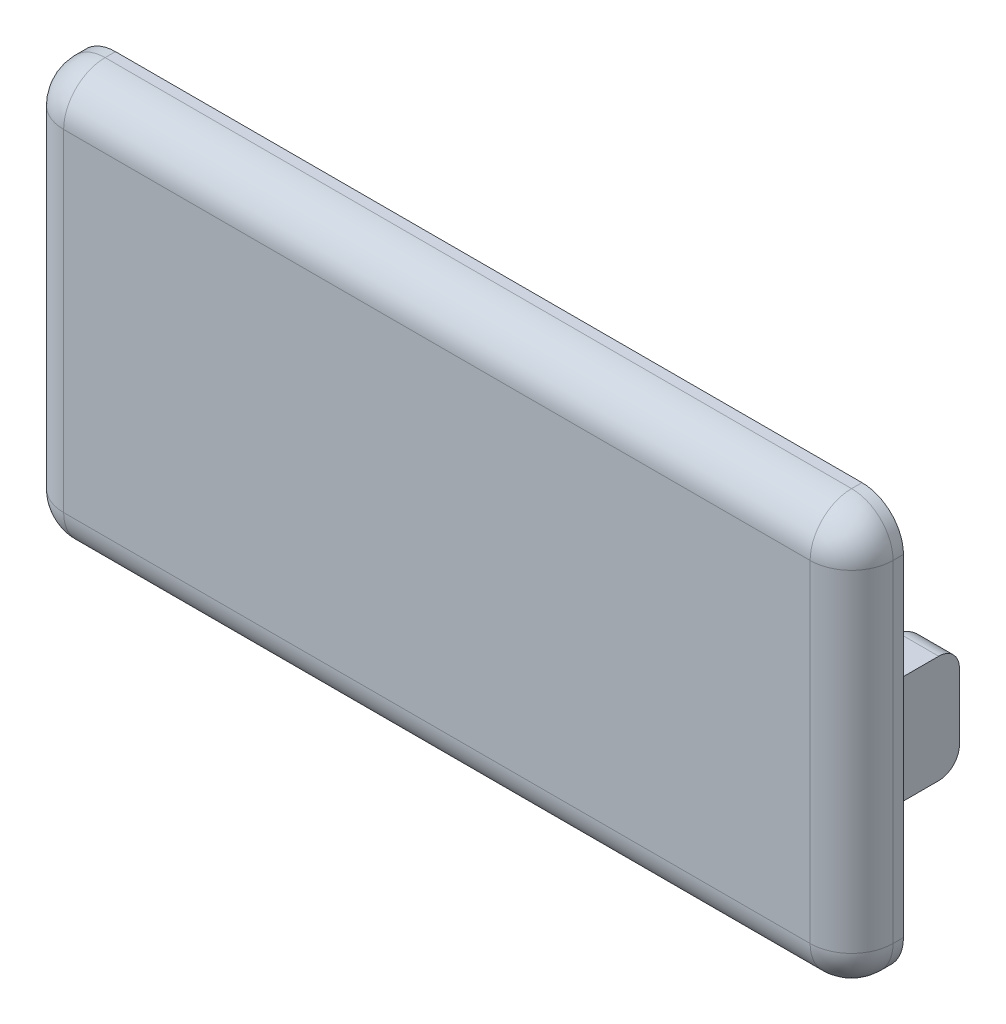
from build123d import *

# Parameters (mm, degrees)
SKETCH1_W           = 40
SKETCH1_H           = 20
BOSS_EXTRUDE1_DEPTH = 2.5
FILLET1_R           = 2
SKETCH2_W           = 34
SKETCH2_H           = 14
CUT_EXTRUDE1_DEPTH  = 1
BOSS_EXTRUDE2_DEPTH = 2.6
FILLET2_R           = 1
BOSS_EXTRUDE3_DEPTH = 7
BOSS_EXTRUDE4_DEPTH = 0.6
LPATTERN1_COUNT     = 2
LPATTERN1_PITCH     = 20


with BuildPart() as part:
    # Sketch1 → Boss-Extrude1 (new body)
    with BuildSketch(Plane.XY):
        Rectangle(SKETCH1_W, SKETCH1_H)
    extrude(amount=BOSS_EXTRUDE1_DEPTH)

    # Fillet1
    fillet1_edges = [part.edges().sort_by_distance(p)[0] for p in [
        (20, 0, 2.5),
        (0, 10, 2.5),
        (-20, 0, 2.5),
        (0, -10, 2.5),
        (-20, 10, 1.25),
        (20, 10, 1.25),
        (20, -10, 1.25),
        (-20, -10, 1.25),
    ]]
    fillet(fillet1_edges, radius=FILLET1_R)

    # Sketch2 → Cut-Extrude1 (cut)
    with BuildSketch(Plane(origin=(0, 0, 0), x_dir=(-1, 0, 0), z_dir=(0, 0, -1))):
        Rectangle(SKETCH2_W, SKETCH2_H)
    extrude(amount=-CUT_EXTRUDE1_DEPTH, mode=Mode.SUBTRACT)

    # Sketch3 → Boss-Extrude2 (add, symmetric)
    with BuildSketch(Plane(origin=(0, 0, 0), x_dir=(0, 0, -1), z_dir=(0, 1, 0))):
        Polygon((0, -17), (3, -18.091910703), (3, -19.7), (0, -19.7), align=None)
    extrude(amount=BOSS_EXTRUDE2_DEPTH, both=True)

    # Fillet2
    fillet2_edges = [part.edges().sort_by_distance(p)[0] for p in [
        (18.895955351, -2.6, -3),
        (18.895955351, 2.6, -3),
    ]]
    fillet(fillet2_edges, radius=FILLET2_R)

    # Sketch4 → Boss-Extrude3 (add)
    with BuildSketch(Plane(origin=(0, 0, 1), x_dir=(-1, 0, 0), z_dir=(0, 0, -1))):
        with BuildLine():
            Line((-12.015564437, -1), (-11, -1))
            Line((-11, -1), (-11, -2.015564437))
            ThreePointArc((-11, -2.015564437), (-10, -2.25), (-9, -2.015564437))
            Line((-9, -2.015564437), (-9, -1))
            Line((-9, -1), (-7.984435563, -1))
            ThreePointArc((-7.984435563, -1), (-7.75, 0), (-7.984435563, 1))
            Line((-7.984435563, 1), (-9, 1))
            Line((-9, 1), (-9, 2.015564437))
            ThreePointArc((-9, 2.015564437), (-10, 2.25), (-11, 2.015564437))
            Line((-11, 2.015564437), (-11, 1))
            Line((-11, 1), (-12.015564437, 1))
            ThreePointArc((-12.015564437, 1), (-12.25, 0), (-12.015564437, -1))
        make_face()
    boss_extrude3 = extrude(amount=BOSS_EXTRUDE3_DEPTH)

    # Sketch5 → Cut-Revolve1 (revolve, cut)
    with BuildSketch(Plane(origin=(0, 0, 0), x_dir=(0, 0, -1), z_dir=(0, 1, 0))):
        with BuildLine():
            Line((4, -7.75), (6, -7.75))
            Line((6, -7.75), (6, -8.522203777))
            ThreePointArc((6, -8.522203777), (5.883022222, -8.200809972), (5.586824089, -8.0297999))
            Line((5.586824089, -8.0297999), (4, -7.75))
        make_face()
    cut_revolve1 = revolve(axis=Axis((10, 0, 1), (0, 0, -1)), mode=Mode.SUBTRACT)

    # Sketch6 → Boss-Extrude4 (add)
    with BuildSketch(Plane(origin=(0, 0, 1), x_dir=(-1, 0, 0), z_dir=(0, 0, -1))):
        with BuildLine():
            Line((-13.354101966, -1), (-6.645898034, -1))
            ThreePointArc((-6.645898034, -1), (-6.5, 0), (-6.645898034, 1))
            Line((-6.645898034, 1), (-13.354101966, 1))
            ThreePointArc((-13.354101966, 1), (-13.5, 0), (-13.354101966, -1))
        make_face()
    boss_extrude4 = extrude(amount=BOSS_EXTRUDE4_DEPTH)

    # LPattern1: Boss-Extrude3, Cut-Revolve1, Boss-Extrude4 ×2
    with Locations(*[(-i * LPATTERN1_PITCH, 0, 0) for i in range(1, LPATTERN1_COUNT)]):
        add(boss_extrude3)
        add(cut_revolve1, mode=Mode.SUBTRACT)
        add(boss_extrude4)


solid = part.part
